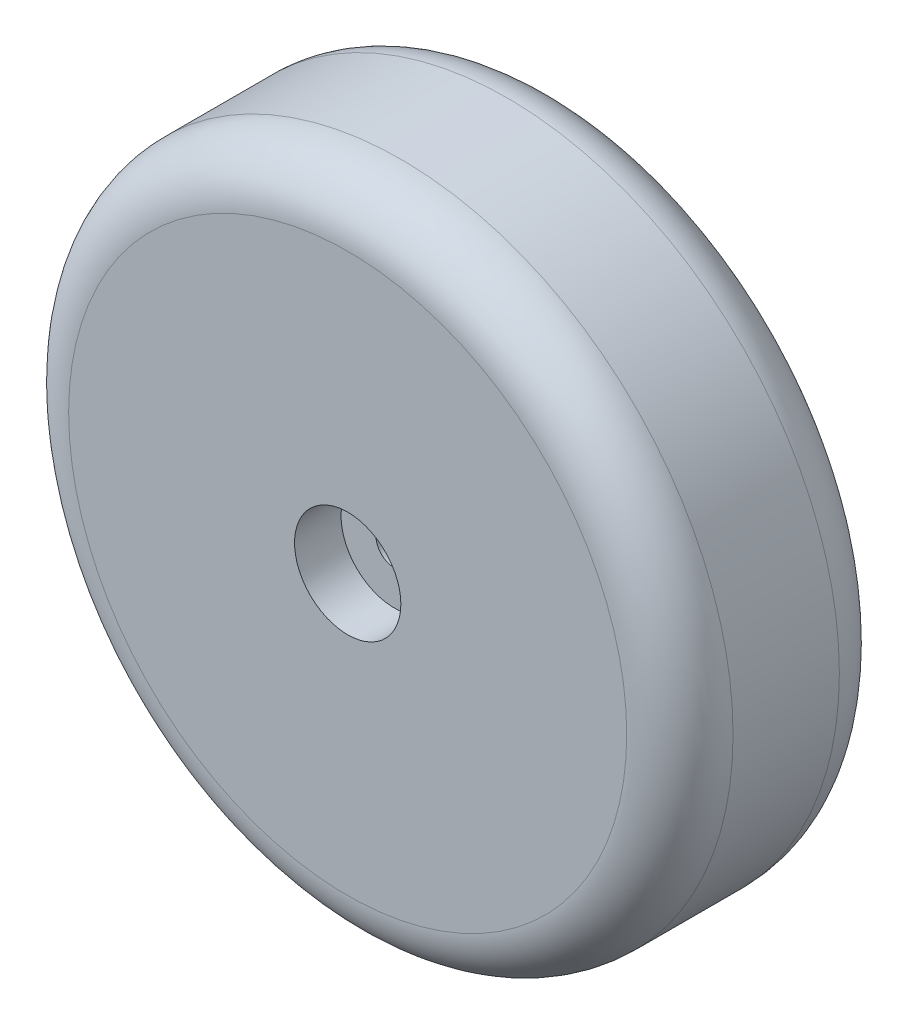
from build123d import *

# Parameters (mm, degrees)
SKETCH_1_R          = 50
EXTRUDE_1_DEPTH     = 32
SKETCH_2_R          = 2.75
CUT_EXTRUDE_1_DEPTH = 78.614431648
FILLET_1_R          = 8
SKETCH_3_R          = 8
CUT_EXTRUDE_2_DEPTH = 7
CUT_EXTRUDE_START   = -7
SKETCH_4_R          = 8
CUT_EXTRUDE_3_DEPTH = 7


with BuildPart() as part:
    # 草图1 → 凸台-拉伸1 (new body)
    with BuildSketch(Plane.XY):
        Circle(SKETCH_1_R)
    extrude(amount=EXTRUDE_1_DEPTH)

    # 草图2 → 切除-拉伸1 (cut, through all)
    with BuildSketch(Plane.XY.offset(32)):
        Circle(SKETCH_2_R)
    extrude(amount=-CUT_EXTRUDE_1_DEPTH, mode=Mode.SUBTRACT)

    # 圆角1
    fillet_1_edges = [part.edges().sort_by_distance(p)[0] for p in [
        (-50, 0, 0),
        (-50, 0, 32),
    ]]
    fillet(fillet_1_edges, radius=FILLET_1_R)

    # 草图3 → 切除-拉伸2 (cut)
    with BuildSketch(Plane.XY.offset(32)):
        Circle(SKETCH_3_R)
    extrude(amount=-CUT_EXTRUDE_2_DEPTH, mode=Mode.SUBTRACT)

    # 草图4 → 切除-拉伸3 (cut)
    with BuildSketch(Plane(origin=(0, 0, 0), x_dir=(-1, 0, 0), z_dir=(0, 0, -1)).offset(CUT_EXTRUDE_START)):
        with Locations(Location((0, 0, 0), (0, 0, 180))):
            Circle(SKETCH_4_R)
    extrude(amount=CUT_EXTRUDE_3_DEPTH, mode=Mode.SUBTRACT)


solid = part.part
